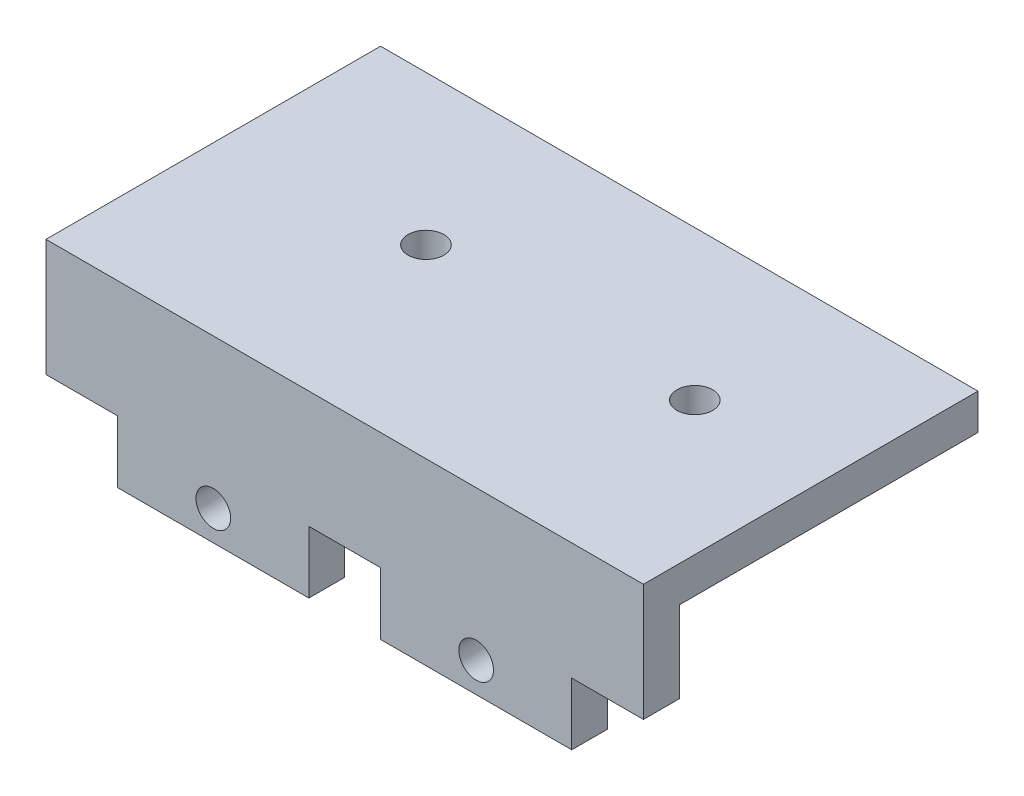
from build123d import *

# Parameters (mm, degrees)
SKETCH1_W                = 50
SKETCH1_H                = 25
SKETCH1_R                = 1.3
SKETCH1_R_2              = 4.5
BOSS_EXTRUDE1_DEPTH      = 2.5
SKETCH2_W                = 50
SKETCH2_H                = 12
BOSS_EXTRUDE2_DEPTH      = 3
SKETCH3_W                = 50
SKETCH3_H                = 28
BOSS_EXTRUDE3_DEPTH      = 3
SKETCH4_R                = 1.3
CUT_EXTRUDE1_DEPTH       = 34.018933962
SKETCH5_W                = 53
SKETCH5_H                = 32.5
SKETCH5_R                = 1.6
SKETCH5_W_2              = 42
SKETCH5_H_2              = 21.5
BOSS_EXTRUDE4_DEPTH      = 4
SKETCH7_R                = 8
CUT_EXTRUDE2_DEPTH       = 5
SKETCH8_W                = 24.55
SKETCH8_H                = 21.5
CUT_EXTRUDE3_DEPTH       = 3.8
BOSS_EXTRUDE6_DEPTH      = 22.95
BOSS_EXTRUDE7_DEPTH      = 2
CUT_EXTRUDE4_START       = -1.2
SKETCH11_R               = 1.6
CUT_EXTRUDE4_DEPTH       = 1.2
SKETCH12_W               = 7
SKETCH12_H               = 21
SKETCH12_R               = 1.6
BOSS_EXTRUDE8_DEPTH      = 7.8
CUT_EXTRUDE5_DEPTH       = 55.054972019
CUT_EXTRUDE5_DEPTH_BACK  = 55.054972019
SKETCH13_W               = 0.7
SKETCH13_H               = 5
SKETCH13_H_2             = 4
CUT_EXTRUDE6_DEPTH       = 78.713850117
CUT_EXTRUDE6_DEPTH_BACK  = 78.713850117
SKETCH14_W               = 3
SKETCH14_H               = 4
SKETCH14_W_2             = 25
SKETCH14_H_2             = 5
CUT_EXTRUDE7_DEPTH       = 54.247089122
CUT_EXTRUDE7_DEPTH_BACK  = 54.247089122
SKETCH15_W               = 24.95
SKETCH15_H               = 3
CUT_EXTRUDE8_DEPTH       = 40.563240514
CUT_EXTRUDE8_DEPTH_BACK  = 40.563240514
SKETCH16_R               = 1.45
SKETCH16_W               = 6
SKETCH16_H               = 5.2
CUT_EXTRUDE9_DEPTH       = 34.018933962
CUT_EXTRUDE9_DEPTH_BACK  = 34.018933962
SKETCH18_R               = 1.5
SKETCH19_R               = 1.3
BOSS_EXTRUDE9_DEPTH      = 3
CUT_EXTRUDE10_DEPTH      = 34.018933962
CUT_EXTRUDE10_DEPTH_BACK = 34.018933962
SKETCH20_R               = 1.5


with BuildPart() as part:
    # Sketch1 → Boss-Extrude1 (new, symmetric)
    with BuildSketch(Plane(origin=(0, 0, 0), x_dir=(1, 0, 0), z_dir=(0, 1, 0))):
        Rectangle(SKETCH1_W, SKETCH1_H)
        with Locations(Location((-11.25, 0, 0), (0, 0, 270))):
            Circle(SKETCH1_R, mode=Mode.SUBTRACT)
        with Locations(Location((11.25, 0, 0), (0, 0, 270))):
            Circle(SKETCH1_R_2, mode=Mode.SUBTRACT)
    extrude(amount=BOSS_EXTRUDE1_DEPTH, both=True)

    # Sketch2 → Boss-Extrude2 (add)
    with BuildSketch(Plane.XY.offset(12.5)):
        with Locations((0, 3.5)):
            Rectangle(SKETCH2_W, SKETCH2_H)
    extrude(amount=BOSS_EXTRUDE2_DEPTH)

    # Sketch3 → Boss-Extrude3 (add)
    with BuildSketch(Plane(origin=(0, 9.5, 0), x_dir=(1, 0, 0), z_dir=(0, 1, 0))):
        with Locations((0, -1.5)):
            Rectangle(SKETCH3_W, SKETCH3_H)
    extrude(amount=BOSS_EXTRUDE3_DEPTH)

    # Sketch4 → Cut-Extrude1 (cut, through all)
    with BuildSketch(Plane(origin=(0, 12.5, 0), x_dir=(1, 0, 0), z_dir=(0, 1, 0))):
        with Locations(Location((11.25, 0, 0), (0, 0, 270))):
            Circle(SKETCH4_R)
        with Locations(Location((-11.25, 0, 0), (0, 0, 270))):
            Circle(SKETCH4_R)
    extrude(amount=-CUT_EXTRUDE1_DEPTH, mode=Mode.SUBTRACT)

    # Sketch5 → Boss-Extrude4 (add)
    with BuildSketch(Plane.XZ.offset(2.5)):
        with Locations((21.45, -0.05)):
            Rectangle(SKETCH5_W, SKETCH5_H)
        with Locations(Location((45.75, -5, 0), (0, 0, 270))):
            Circle(SKETCH5_R, mode=Mode.SUBTRACT)
        with Locations(Location((45.75, 4.9, 0), (0, 0, 270))):
            Circle(SKETCH5_R, mode=Mode.SUBTRACT)
        with Locations(Location((-2.85, 4.9, 0), (0, 0, 270))):
            Circle(SKETCH5_R, mode=Mode.SUBTRACT)
        with Locations(Location((-2.85, -5, 0), (0, 0, 270))):
            Circle(SKETCH5_R, mode=Mode.SUBTRACT)
        with Locations((21.45, -0.05)):
            Rectangle(SKETCH5_W_2, SKETCH5_H_2, mode=Mode.SUBTRACT)
    extrude(amount=BOSS_EXTRUDE4_DEPTH)

    # Sketch7 → Cut-Extrude2 (cut)
    with BuildSketch(Plane.XZ.offset(2.5)):
        with Locations(Location((11.25, 0, 0), (0, 0, 270))):
            Circle(SKETCH7_R)
    extrude(amount=-CUT_EXTRUDE2_DEPTH, mode=Mode.SUBTRACT)

    # Sketch8 → Cut-Extrude3 (cut)
    with BuildSketch(Plane.XZ.offset(2.5)):
        with Locations((12.725, -0.05)):
            Rectangle(SKETCH8_W, SKETCH8_H)
    extrude(amount=-CUT_EXTRUDE3_DEPTH, mode=Mode.SUBTRACT)

    # Sketch9 → Boss-Extrude6 (add)
    with BuildSketch(Plane(origin=(25, 0, 0), x_dir=(0, 0, -1), z_dir=(1, 0, 0))):
        Polygon((12.5, 2.5), (-16.2, 2.5), (-16.2, -2.5), (-10.7, -2.5), (-10.7, 1.3), (10.8, 1.3), (10.8, -2.5), (12.5, -2.5), align=None)
    extrude(amount=BOSS_EXTRUDE6_DEPTH)

    # Sketch10 → Boss-Extrude7 (add)
    with BuildSketch(Plane(origin=(47.95, 0, 0), x_dir=(0, 0, -1), z_dir=(1, 0, 0))):
        Polygon((16.3, -2.5), (12.5, -2.5), (12.5, 2.5), (-16.2, 2.5), (-16.2, -6.5), (16.3, -6.5), align=None)
    extrude(amount=BOSS_EXTRUDE7_DEPTH)

    # Sketch11 → Cut-Extrude4 (cut)
    with BuildSketch(Plane.XZ.offset(-1.3).offset(CUT_EXTRUDE4_START)):
        with Locations(Location((-2.85, 4.9, 0), (0, 0, 270))):
            Circle(SKETCH11_R)
        with Locations(Location((-2.85, -5, 0), (0, 0, 270))):
            Circle(SKETCH11_R)
        with Locations(Location((45.75, 4.9, 0), (0, 0, 270))):
            Circle(SKETCH11_R)
        with Locations(Location((45.75, -5, 0), (0, 0, 270))):
            Circle(SKETCH11_R)
    extrude(amount=CUT_EXTRUDE4_DEPTH, mode=Mode.SUBTRACT)

    # Sketch12 → Boss-Extrude8 (add)
    with BuildSketch(Plane.XZ.offset(-1.3)):
        with Locations((46.45, 0.2)):
            Rectangle(SKETCH12_W, SKETCH12_H)
        with Locations(Location((45.75, 4.9, 0), (0, 0, 90))):
            Circle(SKETCH12_R, mode=Mode.SUBTRACT)
        with Locations(Location((45.75, -5, 0), (0, 0, 90))):
            Circle(SKETCH12_R, mode=Mode.SUBTRACT)
    extrude(amount=BOSS_EXTRUDE8_DEPTH)

    # Sketch13 → Cut-Extrude5 (cut, two sides: drawn at the far end of the back side and taken through both)
    with BuildSketch(Plane.ZY.offset(-25).offset(-CUT_EXTRUDE5_DEPTH_BACK)):
        with Locations((15.85, 0)):
            Rectangle(SKETCH13_W, SKETCH13_H)
        with Locations((15.85, -4.5)):
            Rectangle(SKETCH13_W, SKETCH13_H_2)
    extrude(amount=CUT_EXTRUDE5_DEPTH + CUT_EXTRUDE5_DEPTH_BACK, mode=Mode.SUBTRACT)

    # Sketch14 → Cut-Extrude6 (cut, two sides: drawn at the far end of the back side and taken through both)
    with BuildSketch(Plane.ZY.offset(25).offset(-CUT_EXTRUDE6_DEPTH_BACK)):
        with Locations((14, -4.5)):
            Rectangle(SKETCH14_W, SKETCH14_H)
        Polygon((-16.3, 2.5), (-16.3, -6.5), (12.5, -6.5), (12.5, -2.5), (-12.5, -2.5), (-12.5, 2.5), align=None)
        Rectangle(SKETCH14_W_2, SKETCH14_H_2)
    extrude(amount=CUT_EXTRUDE6_DEPTH + CUT_EXTRUDE6_DEPTH_BACK, mode=Mode.SUBTRACT)

    # Sketch15 → Cut-Extrude7 (cut, two sides: drawn at the far end of the back side and taken through both)
    with BuildSketch(Plane(origin=(0, 2.5, 0), x_dir=(1, 0, 0), z_dir=(0, 1, 0)).offset(-CUT_EXTRUDE7_DEPTH_BACK)):
        with Locations((37.475, -14)):
            Rectangle(SKETCH15_W, SKETCH15_H)
    extrude(amount=CUT_EXTRUDE7_DEPTH + CUT_EXTRUDE7_DEPTH_BACK, mode=Mode.SUBTRACT)

    # Sketch16 → Cut-Extrude8 (cut, two sides: drawn at the far end of the back side and taken through both)
    with BuildSketch(Plane.XY.offset(15.5).offset(-CUT_EXTRUDE8_DEPTH_BACK)):
        with Locations(Location((-11, 0, 0), (0, 0, 180))):
            Circle(SKETCH16_R)
        with Locations(Location((11, 0, 0), (0, 0, 180))):
            Circle(SKETCH16_R)
        with Locations((-22, 0.1)):
            Rectangle(SKETCH16_W, SKETCH16_H)
        with Locations((0, 0.1)):
            Rectangle(SKETCH16_W, SKETCH16_H)
        with Locations((22, 0.1)):
            Rectangle(SKETCH16_W, SKETCH16_H)
    extrude(amount=CUT_EXTRUDE8_DEPTH + CUT_EXTRUDE8_DEPTH_BACK, mode=Mode.SUBTRACT)

    # Sketch18 → Cut-Extrude9 (cut, two sides: drawn at the far end of the back side and taken through both)
    with BuildSketch(Plane(origin=(0, 12.5, 0), x_dir=(1, 0, 0), z_dir=(0, 1, 0)).offset(-CUT_EXTRUDE9_DEPTH_BACK)):
        with Locations((-8.7, 0)):
            Circle(SKETCH18_R)
    extrude(amount=CUT_EXTRUDE9_DEPTH + CUT_EXTRUDE9_DEPTH_BACK, mode=Mode.SUBTRACT)

    # Sketch19 → Boss-Extrude9 (add)
    with BuildSketch(Plane(origin=(0, 12.5, 0), x_dir=(1, 0, 0), z_dir=(0, 1, 0))):
        with BuildLine():
            ThreePointArc((-10.084803922, -0.57647038), (-10.2, 0), (-10.084803922, 0.57647038))
            ThreePointArc((-10.084803922, 0.57647038), (-12.55, 0), (-10.084803922, -0.57647038))
        make_face()
        with Locations((11.25, 0)):
            Circle(SKETCH19_R)
    extrude(amount=-BOSS_EXTRUDE9_DEPTH)

    # Sketch20 → Cut-Extrude10 (cut, two sides: drawn at the far end of the back side and taken through both)
    with BuildSketch(Plane(origin=(0, 12.5, 0), x_dir=(1, 0, 0), z_dir=(0, 1, 0)).offset(-CUT_EXTRUDE10_DEPTH_BACK)):
        with Locations(Location((13.8, 0, 0), (0, 0, 270))):
            Circle(SKETCH20_R)
    extrude(amount=CUT_EXTRUDE10_DEPTH + CUT_EXTRUDE10_DEPTH_BACK, mode=Mode.SUBTRACT)


solid = part.part
